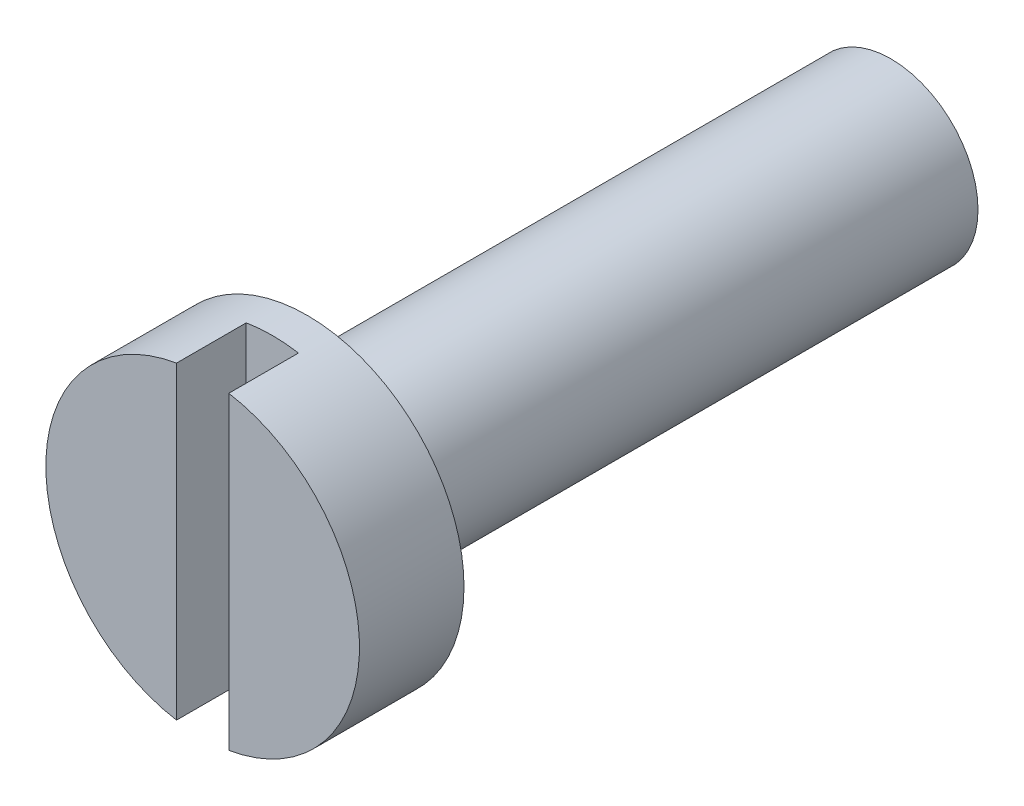
from build123d import *

# Parameters (mm, degrees)
SKETCH_1_R             = 2.5
EXTRUDE_1_DEPTH        = 16.75
SKETCH_2_R             = 4.5
EXTRUDE_2_DEPTH        = 3
SKETCH_4_W             = 1.5
SKETCH_4_H             = 10.936891942
CUT_EXTRUDE_1_DEPTH    = 2
HOLE_WIZARD_M3_1_D     = 2.5
HOLE_WIZARD_M3_1_DEPTH = 10
HOLE_WIZARD_M3_1_TIP   = 0.751075774


with BuildPart() as part:
    # 草图1 → 凸台-拉伸1 (new body)
    with BuildSketch(Plane.XY):
        Circle(SKETCH_1_R)
    extrude(amount=EXTRUDE_1_DEPTH)

    # 草图2 → 凸台-拉伸2 (add)
    with BuildSketch(Plane.XY.offset(16.75)):
        Circle(SKETCH_2_R)
    extrude(amount=EXTRUDE_2_DEPTH)

    # 草图4 → 切除-拉伸1 (cut)
    with BuildSketch(Plane.XY.offset(19.75)):
        Rectangle(SKETCH_4_W, SKETCH_4_H)
    extrude(amount=-CUT_EXTRUDE_1_DEPTH, mode=Mode.SUBTRACT)

    # M3 螺纹孔的螺纹孔钻头1
    with Locations(Plane(origin=(0, 0, 0), x_dir=(-1, 0, 0), z_dir=(0, 0, -1))):
        with Locations((0, 0)):
            Hole(HOLE_WIZARD_M3_1_D / 2, depth=HOLE_WIZARD_M3_1_DEPTH)
            with Locations((0, 0, -(HOLE_WIZARD_M3_1_DEPTH + HOLE_WIZARD_M3_1_TIP / 2))):  # 118° drill point
                Cone(0, HOLE_WIZARD_M3_1_D / 2, HOLE_WIZARD_M3_1_TIP, mode=Mode.SUBTRACT)


solid = part.part
